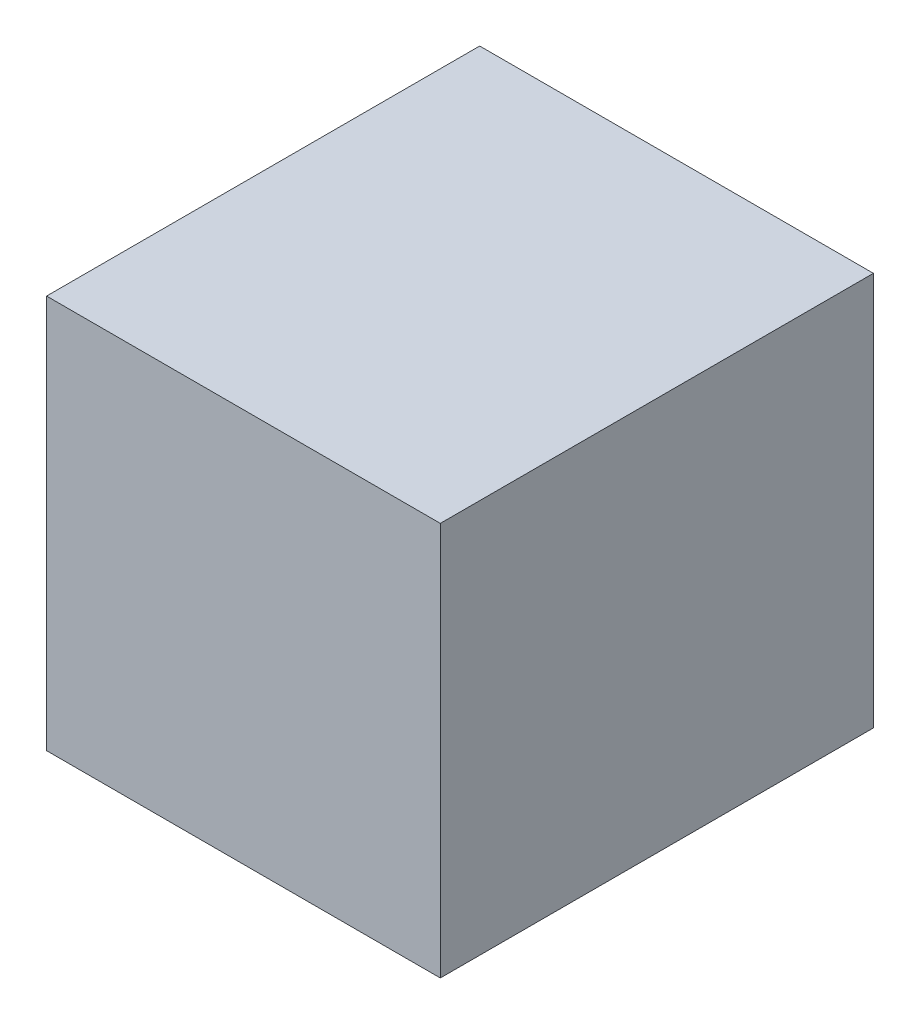
from build123d import *

# Parameters (mm, degrees)
OVEN_PANO_PSU_24V_1_START = -138
SKETCH1_W                 = 100
SKETCH1_H                 = 100
OVEN_PANO_PSU_24V_1_DEPTH = 110


with BuildPart() as part:
    # Sketch1 → OVEN_pano_psu_24V_1 (new body)
    with BuildSketch(Plane.XY.offset(OVEN_PANO_PSU_24V_1_START)):
        with Locations((230, 250)):
            Rectangle(SKETCH1_W, SKETCH1_H)
    extrude(amount=-OVEN_PANO_PSU_24V_1_DEPTH)


solid = part.part
